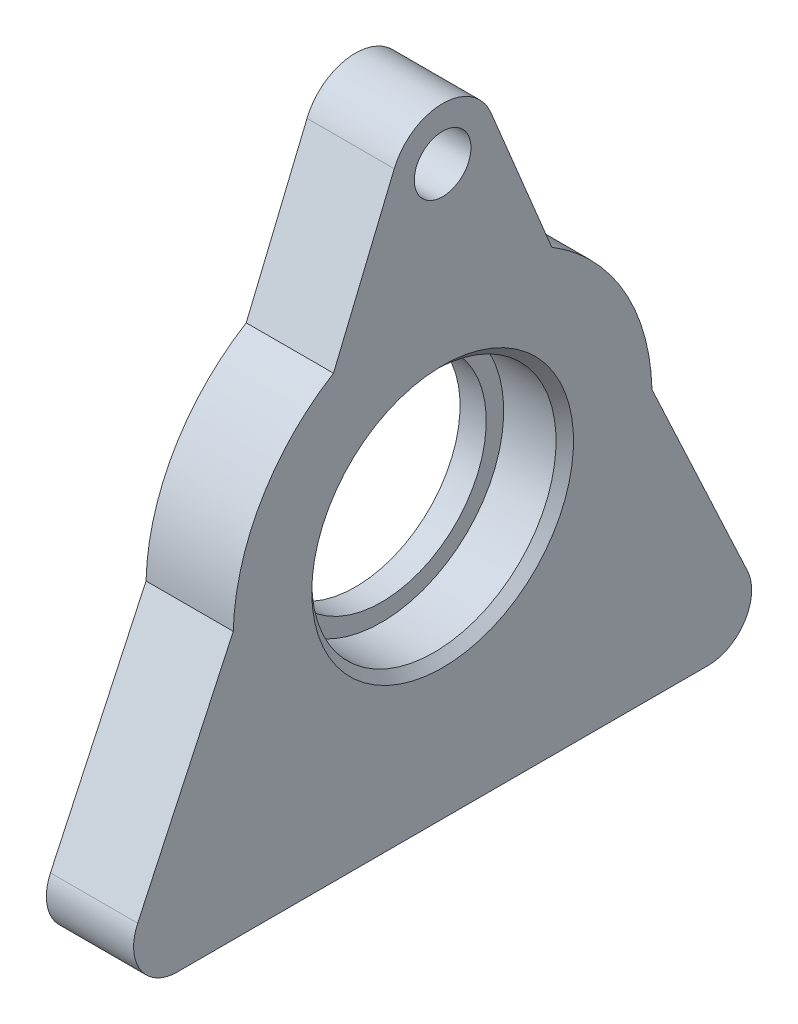
from build123d import *

# Parameters (mm, degrees)
SKETCH_1_W                  = 10
SKETCH_1_H                  = 10
SKETCH_6_R                  = 14
SKETCH_6_R_2                = 12
EXTRUDE_1_DEPTH             = 3
SKETCH_7_R                  = 19.5
EXTRUDE_2_DEPTH             = 10
HOLE_WIZARD_M43_D           = 3.3
HOLE_WIZARD_M43_DEPTH       = 12
HOLE_WIZARD_M43_CSINK_D     = 5
HOLE_WIZARD_M43_CSINK_ANGLE = 90
HOLE_WIZARD_M43_TIP         = 0.991420021
EXTRUDE_START               = -10
EXTRUDE_3_DEPTH             = 10
HOLE_WIZARD_M61_D           = 6.5
CHAMFER_1_SIZE              = 1


with BuildPart() as part:
    # Эскиз1 → Повернуть1 (revolve)
    with BuildSketch(Plane.XY, mode=Mode.PRIVATE) as revolve_1_sk:
        with Locations((5, 19)):
            Rectangle(SKETCH_1_W, SKETCH_1_H)
    revolve(revolve_1_sk.sketch.rotate(Axis((-29.36512031, 0, 0), (1, 0, 0)), 90), axis=Axis((-29.36512031, 0, 0), (1, 0, 0)))

    # Эскиз6 → Бобышка-Вытянуть1 (add)
    with BuildSketch(Plane.ZY):
        Circle(SKETCH_6_R)
        Circle(SKETCH_6_R_2, mode=Mode.SUBTRACT)
    extrude(amount=-EXTRUDE_1_DEPTH)

    # Эскиз7 → Бобышка-Вытянуть2 (add)
    with BuildSketch(Plane.ZY):
        with BuildLine():
            Line((-30.415116076, -30), (30.415116076, -30))
            ThreePointArc((30.415116076, -30), (34.632073305, -27.686498042), (34.946655011, -22.886908691))
            Line((34.946655011, -22.886908691), (19.938771315, 9.297601758))
            ThreePointArc((19.938771315, 9.297601758), (0, 22), (-19.938771315, 9.297601758))
            Line((-19.938771315, 9.297601758), (-34.946655011, -22.886908691))
            ThreePointArc((-34.946655011, -22.886908691), (-34.632073305, -27.686498042), (-30.415116076, -30))
        make_face()
        Circle(SKETCH_7_R, mode=Mode.SUBTRACT)
    extrude(amount=-EXTRUDE_2_DEPTH)

    # Отверстие обработанное метчиком M43
    with Locations(Plane(origin=(0, -30, 0), x_dir=(-1, 0, 0), z_dir=(0, -1, 0))):
        with Locations((-5, 0), (-5, 25), (-5, -25)):
            CounterSinkHole(HOLE_WIZARD_M43_D / 2, HOLE_WIZARD_M43_CSINK_D / 2, depth=HOLE_WIZARD_M43_DEPTH, counter_sink_angle=HOLE_WIZARD_M43_CSINK_ANGLE)
            with Locations((0, 0, -(HOLE_WIZARD_M43_DEPTH + HOLE_WIZARD_M43_TIP / 2))):  # 118° drill point
                Cone(0, HOLE_WIZARD_M43_D / 2, HOLE_WIZARD_M43_TIP, mode=Mode.SUBTRACT)

    # Эскиз10 → Бобышка-Вытянуть3 (add)
    with BuildSketch(Plane.ZY.offset(EXTRUDE_START)):
        with BuildLine():
            Line((-12.507364702, 20.483306086), (-5.543277195, 37.296100594))
            ThreePointArc((-5.543277195, 37.296100594), (0, 41), (5.543277195, 37.296100594))
            Line((5.543277195, 37.296100594), (12.507364702, 20.483306086))
            ThreePointArc((12.507364702, 20.483306086), (0, 24), (-12.507364702, 20.483306086))
        make_face()
    extrude(amount=EXTRUDE_3_DEPTH)

    # Сверло под метчик  спиральное M61 (through all)
    with Locations(Plane.ZY):
        with Locations((0, 35)):
            Hole(HOLE_WIZARD_M61_D / 2)

    # Фаска1
    chamfer_1_edges = [part.edges().sort_by_distance(p)[0] for p in [
        (10, 0, -14),
    ]]
    chamfer(chamfer_1_edges, length=CHAMFER_1_SIZE)


solid = part.part
